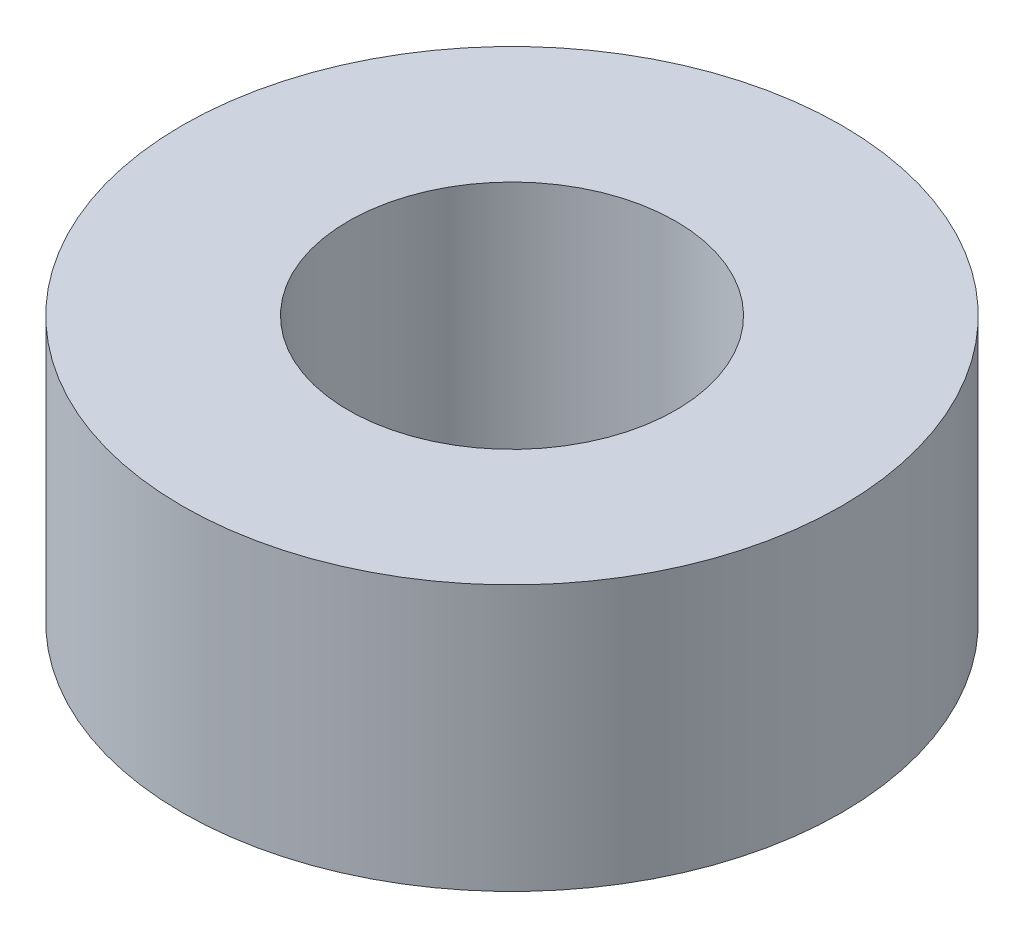
from build123d import *

# Parameters (mm, degrees)
SKETCH1_R           = 9.4615
SKETCH1_R_2         = 4.699
BOSS_EXTRUDE1_DEPTH = 7.62


with BuildPart() as part:
    # Sketch1 → Boss-Extrude1 (new body)
    with BuildSketch(Plane(origin=(0, 0, 0), x_dir=(1, 0, 0), z_dir=(0, 1, 0))):
        with Locations(Location((0, 0, 0), (0, 0, 90))):
            Circle(SKETCH1_R)
        with Locations(Location((0, 0, 0), (0, 0, 90))):
            Circle(SKETCH1_R_2, mode=Mode.SUBTRACT)
    extrude(amount=BOSS_EXTRUDE1_DEPTH)


solid = part.part
